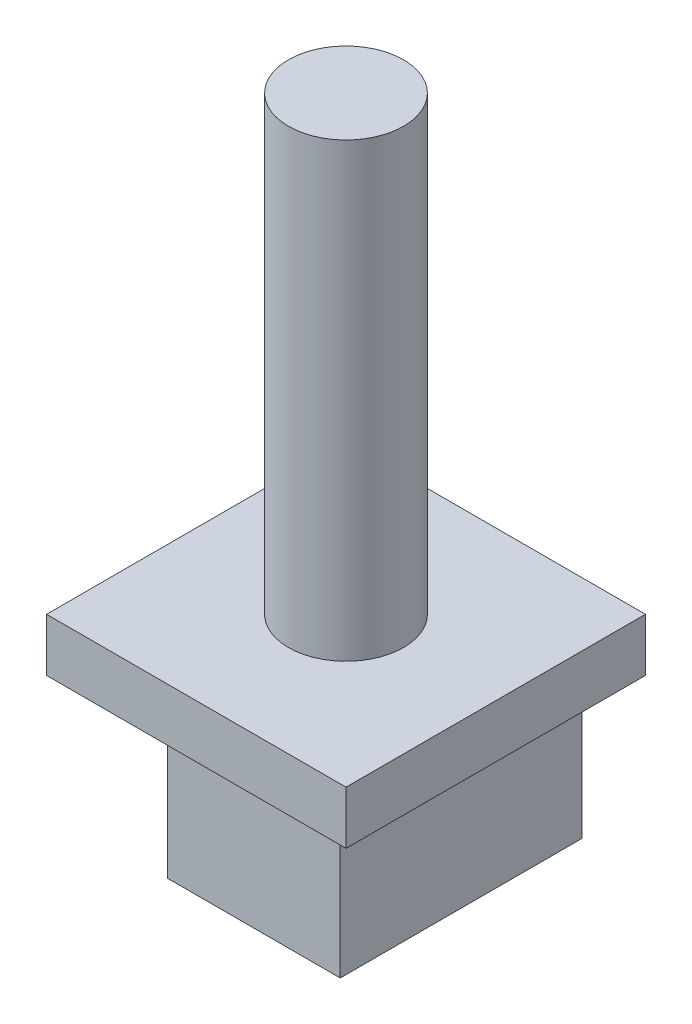
from build123d import *

# Parameters (mm, degrees)
SKETCH1_R           = 6.35
BOSS_EXTRUDE1_DEPTH = 49.784
SKETCH2_W           = 33.02
SKETCH2_H           = 33.02
BOSS_EXTRUDE2_DEPTH = 5.842
SKETCH3_W           = 19.05
SKETCH3_H           = 26.67
BOSS_EXTRUDE3_DEPTH = 19.05


with BuildPart() as part:
    # Sketch1 → Boss-Extrude1 (new body)
    with BuildSketch(Plane(origin=(0, 0, 0), x_dir=(1, 0, 0), z_dir=(0, 1, 0))):
        with Locations(Location((0, 0, 0), (0, 0, 270))):
            Circle(SKETCH1_R)
    extrude(amount=BOSS_EXTRUDE1_DEPTH)

    # Sketch2 → Boss-Extrude2 (add)
    with BuildSketch(Plane.XZ):
        Rectangle(SKETCH2_W, SKETCH2_H)
    extrude(amount=BOSS_EXTRUDE2_DEPTH)

    # Sketch3 → Boss-Extrude3 (add)
    with BuildSketch(Plane.XZ.offset(5.842)):
        with Locations((0, -3.175)):
            Rectangle(SKETCH3_W, SKETCH3_H)
    extrude(amount=BOSS_EXTRUDE3_DEPTH)


solid = part.part
